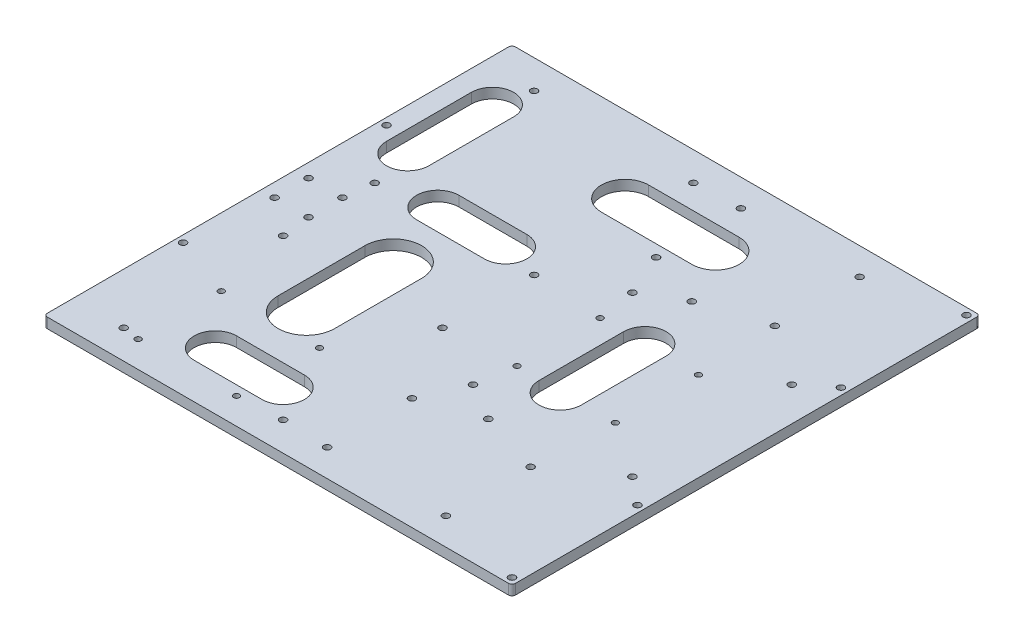
from build123d import *

# Parameters (mm, degrees)
SKETCH_1_W              = 276
SKETCH_1_H              = 276
EXTRUDE_1_DEPTH         = 6
FILLET_1_R              = 2
SKETCH_2_R              = 2
CUT_EXTRUDE_1_DEPTH     = 6
SKETCH_10_R             = 2
CUT_EXTRUDE_1980_DEPTH  = 7
SKETCH_4_R              = 2
CUT_EXTRUDE_94_94_DEPTH = 6
SKETCH_8_R              = 1.75
RPI4_DEPTH              = 6
CUT_EXTRUDE_5_DEPTH     = 6


with BuildPart() as part:
    # Эскиз1 → Бобышка-Вытянуть1 (new body)
    with BuildSketch(Plane(origin=(0, 0, 0), x_dir=(1, 0, 0), z_dir=(0, 1, 0))):
        Rectangle(SKETCH_1_W, SKETCH_1_H)
    extrude(amount=EXTRUDE_1_DEPTH)

    # Скругление1
    fillet_1_edges = [part.edges().sort_by_distance(p)[0] for p in [
        (138, 3, 138),
        (-138, 3, 138),
        (-138, 3, -138),
        (138, 3, -138),
    ]]
    fillet(fillet_1_edges, radius=FILLET_1_R)

    # Эскиз2 → Вырез-Вытянуть1 (cut)
    with BuildSketch(Plane(origin=(0, 6, 0), x_dir=(1, 0, 0), z_dir=(0, 1, 0))):
        with Locations((-134, 60)):
            Circle(SKETCH_2_R)
        with Locations((134, 60)):
            Circle(SKETCH_2_R)
        with Locations((134, -60)):
            Circle(SKETCH_2_R)
        with Locations((-134, -60)):
            Circle(SKETCH_2_R)
        with Locations((46, 60)):
            Circle(SKETCH_2_R)
        with Locations((46, -60)):
            Circle(SKETCH_2_R)
        with Locations((134, 134)):
            Circle(SKETCH_2_R)
        with Locations((134, -134)):
            Circle(SKETCH_2_R)
    extrude(amount=-CUT_EXTRUDE_1_DEPTH, mode=Mode.SUBTRACT)

    # Эскиз10 → Cut-Extrude 1980 (cut)
    with BuildSketch(Plane(origin=(0, 6, 0), x_dir=(1, 0, 0), z_dir=(0, 1, 0))):
        with Locations((13, 122)):
            Circle(SKETCH_10_R)
        with Locations((83, 122)):
            Circle(SKETCH_10_R)
        with Locations((13, 72)):
            Circle(SKETCH_10_R)
        with Locations((83, 72)):
            Circle(SKETCH_10_R)
        with Locations((-130, 10)):
            Circle(SKETCH_10_R)
        with Locations((-110, 10)):
            Circle(SKETCH_10_R)
        with Locations((-110, -10)):
            Circle(SKETCH_10_R)
        with Locations((-130, -10)):
            Circle(SKETCH_10_R)
        with Locations((83, -72)):
            Circle(SKETCH_10_R)
        with Locations((13, -72)):
            Circle(SKETCH_10_R)
        with Locations((83, -122)):
            Circle(SKETCH_10_R)
        with Locations((13, -122)):
            Circle(SKETCH_10_R)
    extrude(amount=-CUT_EXTRUDE_1980_DEPTH, mode=Mode.SUBTRACT)

    # Эскиз4 → 94х94 (cut)
    with BuildSketch(Plane(origin=(0, 6, 0), x_dir=(1, 0, 0), z_dir=(0, 1, 0))):
        with Locations((-108, 121)):
            Circle(SKETCH_4_R)
        with Locations((-14, 121)):
            Circle(SKETCH_4_R)
        with Locations((-14, 27)):
            Circle(SKETCH_4_R)
        with Locations((-108, 27)):
            Circle(SKETCH_4_R)
        with Locations((-108, -27)):
            Circle(SKETCH_4_R)
        with Locations((-14, -27)):
            Circle(SKETCH_4_R)
        with Locations((-14, -121)):
            Circle(SKETCH_4_R)
        with Locations((-108, -121)):
            Circle(SKETCH_4_R)
        with Locations((24, 47)):
            Circle(SKETCH_4_R)
        with Locations((118, 47)):
            Circle(SKETCH_4_R)
        with Locations((118, -47)):
            Circle(SKETCH_4_R)
        with Locations((24, -47)):
            Circle(SKETCH_4_R)
    extrude(amount=-CUT_EXTRUDE_94_94_DEPTH, mode=Mode.SUBTRACT)

    # Эскиз8 → RPi4 (cut)
    with BuildSketch(Plane(origin=(0, 6, 0), x_dir=(1, 0, 0), z_dir=(0, 1, 0))):
        with Locations((85.46549702, 24.5)):
            Circle(SKETCH_8_R)
        with Locations((27.46549702, 24.5)):
            Circle(SKETCH_8_R)
        with Locations((27.46549702, -24.5)):
            Circle(SKETCH_8_R)
        with Locations((85.46549702, -24.5)):
            Circle(SKETCH_8_R)
        with Locations((-40, -73.5)):
            Circle(SKETCH_8_R)
        with Locations((-98, -73.5)):
            Circle(SKETCH_8_R)
        with Locations((-98, -122.5)):
            Circle(SKETCH_8_R)
        with Locations((-40, -122.5)):
            Circle(SKETCH_8_R)
    extrude(amount=-RPI4_DEPTH, mode=Mode.SUBTRACT)

    # Эскиз6 → Вырез-Вытянуть5 (cut)
    with BuildSketch(Plane(origin=(0, 6, 0), x_dir=(1, 0, 0), z_dir=(0, 1, 0))):
        with BuildLine():
            Line((-30.62792666, -91.796358409), (-70.62792666, -91.796358409))
            ThreePointArc((-70.62792666, -91.796358409), (-83.12792666, -104.296358409), (-70.62792666, -116.796358409))
            Line((-70.62792666, -116.796358409), (-30.62792666, -116.796358409))
            ThreePointArc((-30.62792666, -116.796358409), (-18.12792666, -104.296358409), (-30.62792666, -91.796358409))
        make_face()
        with BuildLine():
            Line((-36.854148501, 45.577500198), (-76.854148501, 45.577500198))
            ThreePointArc((-76.854148501, 45.577500198), (-89.354148501, 33.077500198), (-76.854148501, 20.577500198))
            Line((-76.854148501, 20.577500198), (-36.854148501, 20.577500198))
            ThreePointArc((-36.854148501, 20.577500198), (-24.354148501, 33.077500198), (-36.854148501, 45.577500198))
        make_face()
        with BuildLine():
            ThreePointArc((-100.792186218, 101.779020019), (-113.292186218, 114.279020019), (-125.792186218, 101.779020019))
            Line((-125.792186218, 101.779020019), (-125.792186218, 51.779020019))
            ThreePointArc((-125.792186218, 51.779020019), (-113.292186218, 39.279020019), (-100.792186218, 51.779020019))
            Line((-100.792186218, 51.779020019), (-100.792186218, 101.779020019))
        make_face()
        with BuildLine():
            Line((27.18238493, 106.773909834), (-26.207579038, 106.773909834))
            ThreePointArc((-26.207579038, 106.773909834), (-40.115888979, 92.865599892), (-26.207579038, 78.957289951))
            Line((-26.207579038, 78.957289951), (27.18238493, 78.957289951))
            ThreePointArc((27.18238493, 78.957289951), (41.090694872, 92.865599892), (27.18238493, 106.773909834))
        make_face()
        with BuildLine():
            ThreePointArc((-45.432108508, -7.888425697), (-62.147948764, 8.827414559), (-78.86378902, -7.888425697))
            Line((-78.86378902, -7.888425697), (-78.86378902, -59.108123383))
            ThreePointArc((-78.86378902, -59.108123383), (-62.147948764, -75.823963639), (-45.432108508, -59.108123383))
            Line((-45.432108508, -59.108123383), (-45.432108508, -7.888425697))
        make_face()
        with BuildLine():
            ThreePointArc((66.348697743, 24.533398762), (53.848697743, 37.033398762), (41.348697743, 24.533398762))
            Line((41.348697743, 24.533398762), (41.348697743, -25.466601238))
            ThreePointArc((41.348697743, -25.466601238), (53.848697743, -37.966601238), (66.348697743, -25.466601238))
            Line((66.348697743, -25.466601238), (66.348697743, 24.533398762))
        make_face()
    extrude(amount=-CUT_EXTRUDE_5_DEPTH, mode=Mode.SUBTRACT)


solid = part.part
